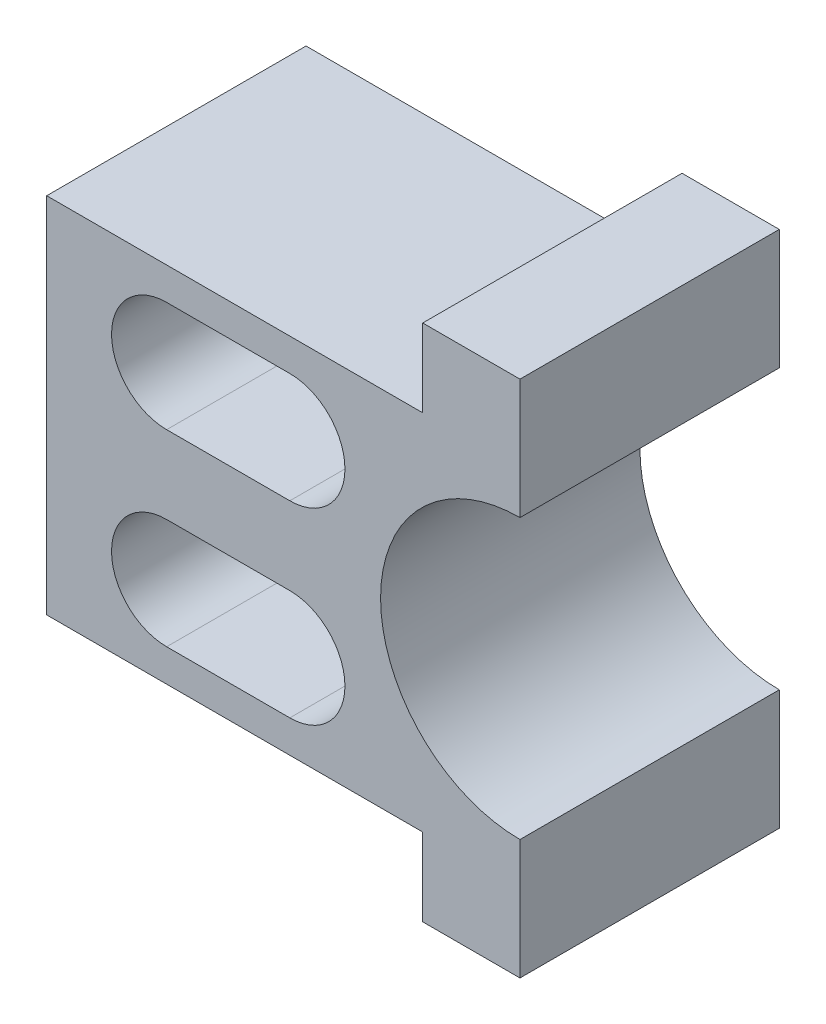
from build123d import *

# Parameters (mm, degrees)
SKETCH_1_W          = 73
SKETCH_1_H          = 80
EXTRUDE_1_DEPTH     = 40
SKETCH_2_R          = 21.5
CUT_EXTRUDE_1_DEPTH = 68.321987493
SKETCH_3_W          = 58
SKETCH_3_H          = 12
CUT_EXTRUDE_5_DEPTH = 68.321987493


with BuildPart() as part:
    # Эскиз1 → Бобышка-Вытянуть1 (new body)
    with BuildSketch(Plane.XY):
        Rectangle(SKETCH_1_W, SKETCH_1_H)
    extrude(amount=EXTRUDE_1_DEPTH)

    # Эскиз2 → Вырез-Вытянуть1 (cut, through all)
    with BuildSketch(Plane.XY.offset(40)):
        with Locations((36.5, 0)):
            Circle(SKETCH_2_R)
        with BuildLine():
            Line((-18, -6), (1, -6))
            ThreePointArc((1, -6), (9.5, -14.5), (1, -23))
            Line((1, -23), (-18, -23))
            ThreePointArc((-18, -23), (-26.5, -14.5), (-18, -6))
        make_face()
        with BuildLine():
            Line((-18, 6), (1, 6))
            ThreePointArc((1, 6), (9.5, 14.5), (1, 23))
            Line((1, 23), (-18, 23))
            ThreePointArc((-18, 23), (-26.5, 14.5), (-18, 6))
        make_face()
    extrude(amount=-CUT_EXTRUDE_1_DEPTH, mode=Mode.SUBTRACT)

    # Эскиз3 → Вырез-Вытянуть5 (cut, through all)
    with BuildSketch(Plane.XY.offset(40)):
        with Locations((-7.5, 34)):
            Rectangle(SKETCH_3_W, SKETCH_3_H)
    cut_extrude_5 = extrude(amount=-CUT_EXTRUDE_5_DEPTH, mode=Mode.SUBTRACT)

    # Зеркальное отражение1: Вырез-Вытянуть5 across plane
    add(cut_extrude_5.mirror(Plane.ZX), mode=Mode.SUBTRACT)


solid = part.part
